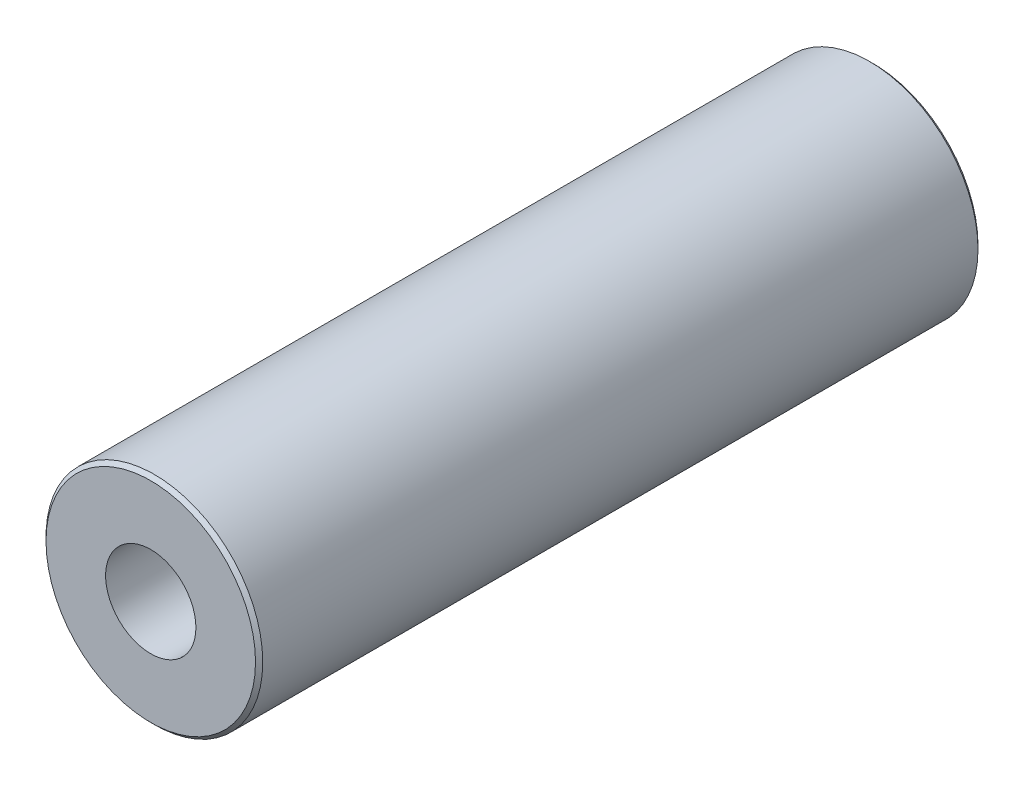
from build123d import *

# Parameters (mm, degrees)
SKETCH_1_R         = 3
EXTRUDE_1_DEPTH    = 10
CHAMFER_1_SIZE     = 0.1
HOLE_WIZARD_M3_1_D = 2.5


with BuildPart() as part:
    # 草图1 → 凸台-拉伸1 (new, symmetric)
    with BuildSketch(Plane.XY):
        Circle(SKETCH_1_R)
    extrude(amount=EXTRUDE_1_DEPTH, both=True)

    # 倒角1
    chamfer_1_edges = [part.edges().sort_by_distance(p)[0] for p in [
        (-3, 0, -10),
        (-3, 0, 10),
    ]]
    chamfer(chamfer_1_edges, length=CHAMFER_1_SIZE)

    # M3 螺纹孔1 (through all)
    with Locations(Plane.XY.offset(10)):
        with Locations((0, 0)):
            Hole(HOLE_WIZARD_M3_1_D / 2)


solid = part.part
